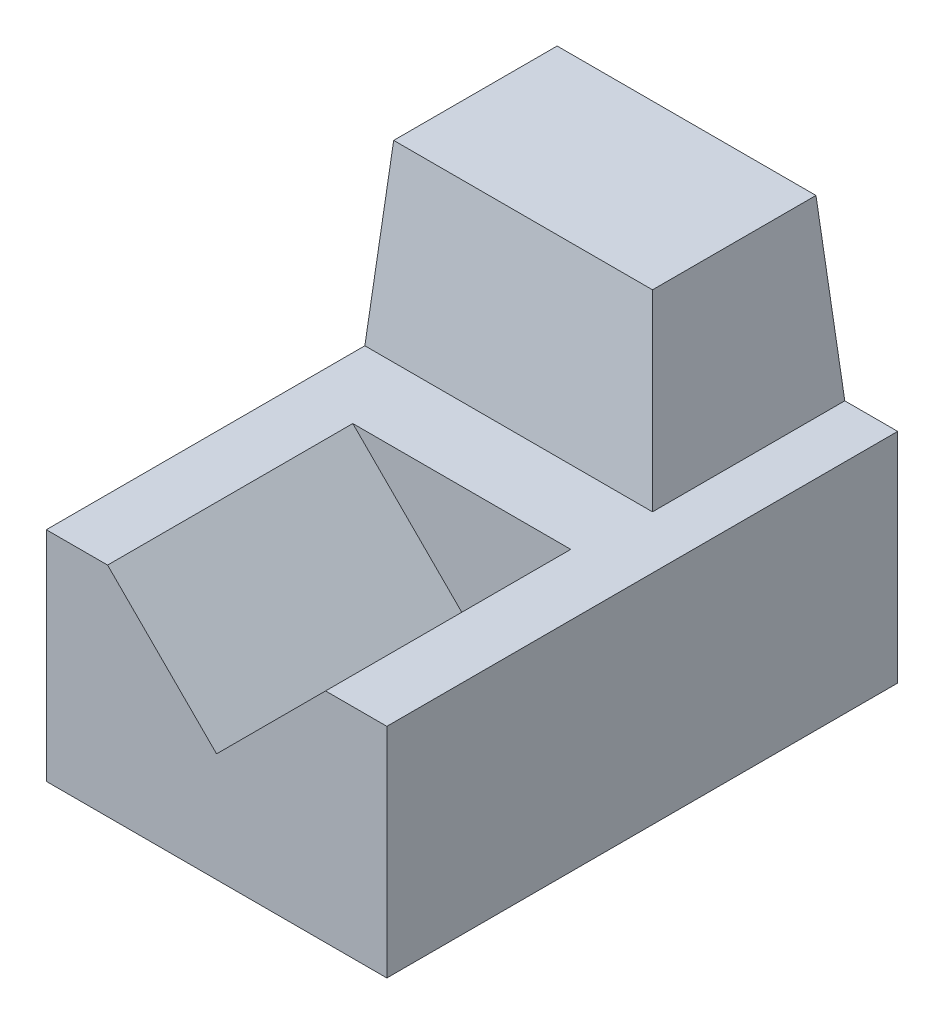
from build123d import *

# Parameters (mm, degrees)
SKETCH1_W           = 50
SKETCH1_H           = 75
BOSS_EXTRUDE1_DEPTH = 16
CUT_EXTRUDE1_DEPTH  = 36
SKETCH3_W           = 38
SKETCH3_H           = 24
BOSS_EXTRUDE4_DEPTH = 24
DRAFT2_ANGLE        = 10


with BuildPart() as part:
    # Sketch1 → Boss-Extrude1 (new, symmetric)
    with BuildSketch(Plane(origin=(0, 0, 0), x_dir=(1, 0, 0), z_dir=(0, 1, 0))):
        Rectangle(SKETCH1_W, SKETCH1_H)
    extrude(amount=BOSS_EXTRUDE1_DEPTH, both=True)

    # Sketch2 → Cut-Extrude1 (cut)
    with BuildSketch(Plane.XY.offset(37.5)):
        Polygon((0, 0), (-16, 16), (16, 16), align=None)
    extrude(amount=-CUT_EXTRUDE1_DEPTH, mode=Mode.SUBTRACT)

    # Sketch3 → Boss-Extrude4 (add)
    with BuildSketch(Plane(origin=(0, 16, 0), x_dir=(1, 0, 0), z_dir=(0, 1, 0))):
        with Locations((-6, 25.5)):
            Rectangle(SKETCH3_W, SKETCH3_H)
    extrude(amount=BOSS_EXTRUDE4_DEPTH)

    # Draft2
    draft2_faces = [part.faces().sort_by_distance(p)[0] for p in [
        (13, 28, -25.5),
        (-6, 28, -13.5),
    ]]
    draft(draft2_faces, Plane.ZX.offset(40), DRAFT2_ANGLE)


solid = part.part
